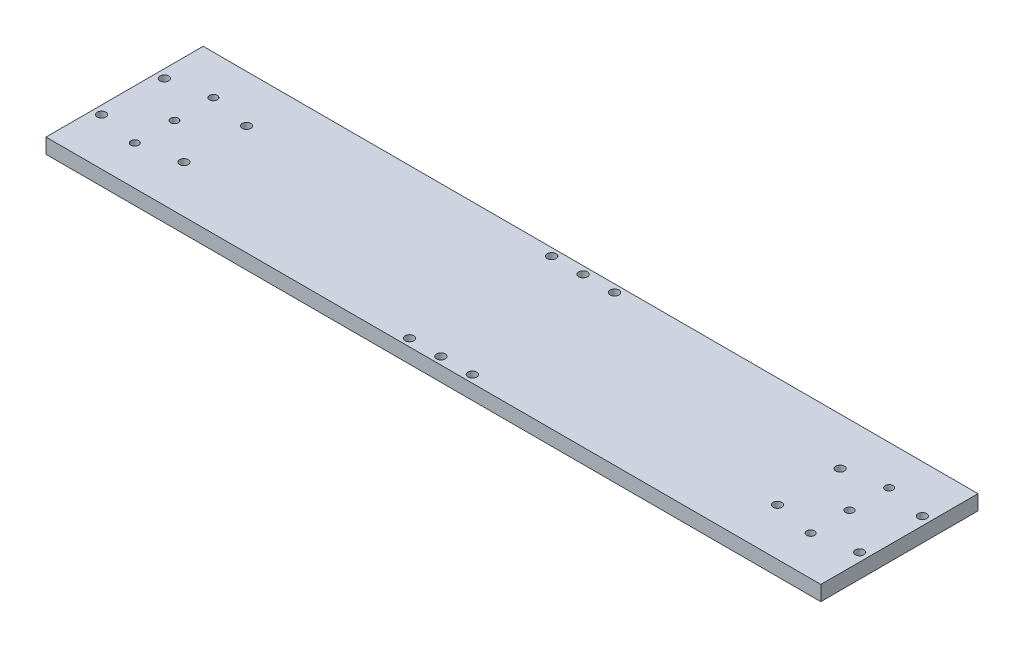
from build123d import *

# Parameters (mm, degrees)
RESSALTO_EXTRUS_O1_DEPTH        = 9.525
ESBO_O5_R                       = 2.78
CORTE_EXTRUS_O2_DEPTH           = 10
ESBO_O8_R                       = 2.75
CORTE_EXTRUS_O4_DEPTH           = 10
ESBO_O9_R                       = 5
CORTE_EXTRUS_O5_DEPTH           = 0.7
ESBO_O10_R                      = 5
CORTE_EXTRUS_O6_DEPTH           = 2.5
CORTE_EXTRUS_O6_DRAFT           = -45
CORTE_EXTRUS_O6_PROFILE_2_DEPTH = 2.5
CORTE_EXTRUS_O6_PROFILE_2_DRAFT = -45
CORTE_EXTRUS_O6_PROFILE_3_DEPTH = 2.5
CORTE_EXTRUS_O6_PROFILE_3_DRAFT = -45
CORTE_EXTRUS_O6_PROFILE_4_DEPTH = 2.5
CORTE_EXTRUS_O6_PROFILE_4_DRAFT = -45
CORTE_EXTRUS_O6_PROFILE_5_DEPTH = 2.5
CORTE_EXTRUS_O6_PROFILE_5_DRAFT = -45
CORTE_EXTRUS_O6_PROFILE_6_DEPTH = 2.5
CORTE_EXTRUS_O6_PROFILE_6_DRAFT = -45
ESBO_O11_R                      = 2.5
CORTE_EXTRUS_O7_DEPTH           = 10


with BuildPart() as part:
    # Esboço3 → Ressalto-extrusão1 (new body)
    with BuildSketch(Plane(origin=(0, 0, 0), x_dir=(1, 0, 0), z_dir=(0, 1, 0))):
        Polygon((-183.495, 37.21932618), (-246.505, 50), (-246.505, -50), (-183.495, -50), align=None)
        Polygon((-183.495, 50), (-183.495, 37.21932618), (183.495, -37.21932618), (183.495, 50), align=None)
        Polygon((183.495, -37.21932618), (-183.495, 37.21932618), (-183.495, -50), (183.495, -50), align=None)
        Polygon((246.505, -50), (183.495, -37.21932618), (183.495, -50), align=None)
        Polygon((183.495, 50), (183.495, -37.21932618), (246.505, -50), (246.505, 50), align=None)
        Polygon((-183.495, 50), (-246.505, 50), (-183.495, 37.21932618), align=None)
    extrude(amount=-RESSALTO_EXTRUS_O1_DEPTH)

    # Esboço5 → Corte-extrusão2 (cut)
    with BuildSketch(Plane(origin=(0, 0, 0), x_dir=(1, 0, 0), z_dir=(0, 1, 0))):
        with Locations(Location((0, -45.235, 0), (0, 0, 270))):
            Circle(ESBO_O5_R)
        with Locations(Location((-20, -45.235, 0), (0, 0, 270))):
            Circle(ESBO_O5_R)
        with Locations(Location((20, -45.235, 0), (0, 0, 270))):
            Circle(ESBO_O5_R)
        with Locations(Location((-20, 45.235, 0), (0, 0, 270))):
            Circle(ESBO_O5_R)
        with Locations(Location((20, 45.235, 0), (0, 0, 270))):
            Circle(ESBO_O5_R)
        with Locations(Location((0, 45.235, 0), (0, 0, 270))):
            Circle(ESBO_O5_R)
    extrude(amount=-CORTE_EXTRUS_O2_DEPTH, mode=Mode.SUBTRACT)

    # Esboço8 → Corte-extrusão4 (cut)
    with BuildSketch(Plane.XZ.offset(9.525)):
        with Locations(Location((-188.84, 19.950903247, 0), (0, 0, 270))):
            Circle(ESBO_O8_R)
        with Locations(Location((-188.84, -19.95, 0), (0, 0, 270))):
            Circle(ESBO_O8_R)
        with Locations(Location((-241.16, 19.950903247, 0), (0, 0, 270))):
            Circle(ESBO_O8_R)
        with Locations(Location((-241.16, -19.95, 0), (0, 0, 270))):
            Circle(ESBO_O8_R)
        with Locations(Location((241.16, -19.95, 0), (0, 0, 90))):
            Circle(ESBO_O8_R)
        with Locations(Location((241.16, 19.950903247, 0), (0, 0, 90))):
            Circle(ESBO_O8_R)
        with Locations(Location((188.84, -19.95, 0), (0, 0, 90))):
            Circle(ESBO_O8_R)
        with Locations(Location((188.84, 19.950903247, 0), (0, 0, 90))):
            Circle(ESBO_O8_R)
    extrude(amount=-CORTE_EXTRUS_O4_DEPTH, mode=Mode.SUBTRACT)

    # Esboço9 → Corte-extrusão5 (cut)
    with BuildSketch(Plane.XZ.offset(9.525)):
        with Locations(Location((215, 25, 0), (0, 0, 270))):
            Circle(ESBO_O9_R)
        with Locations(Location((215, 0, 0), (0, 0, 270))):
            Circle(ESBO_O9_R)
        with Locations(Location((215, -25, 0), (0, 0, 270))):
            Circle(ESBO_O9_R)
        with Locations(Location((-215, -25, 0), (0, 0, 90))):
            Circle(ESBO_O9_R)
        with Locations(Location((-215, 0, 0), (0, 0, 90))):
            Circle(ESBO_O9_R)
        with Locations(Location((-215, 25, 0), (0, 0, 90))):
            Circle(ESBO_O9_R)
    extrude(amount=-CORTE_EXTRUS_O5_DEPTH, mode=Mode.SUBTRACT)


with BuildPart() as corte_extrus_o6_tool:
    # Esboço10 → Corte-extrusão6 (with draft: the straight prism first)
    with BuildSketch(Plane.XZ.offset(8.825)):
        with Locations(Location((215, 25, 0), (0, 0, 270))):
            Circle(ESBO_O10_R)
    extrude(amount=-CORTE_EXTRUS_O6_DEPTH)
    # Corte-extrusão6: the draft: its side faces are tilted about the plane it starts from
    corte_extrus_o6_sides = [corte_extrus_o6_tool.faces().sort_by_distance(p)[0] for p in [
        (215, -7.575, 30),
    ]]
    draft(corte_extrus_o6_sides, Plane.XZ.offset(8.825), CORTE_EXTRUS_O6_DRAFT)


with BuildPart() as part_1:
    add(part.part)

    # Corte-extrusão6: cut by corte_extrus_o6_tool
    add(corte_extrus_o6_tool.part, mode=Mode.SUBTRACT)


with BuildPart() as corte_extrus_o6_profile_2_tool:
    # Esboço10 → Corte-extrusão6 profile 2 (with draft: the straight prism first)
    with BuildSketch(Plane.XZ.offset(8.825)):
        with Locations((214.7625, 0)):
            Circle(ESBO_O10_R)
    extrude(amount=-CORTE_EXTRUS_O6_PROFILE_2_DEPTH)
    # Corte-extrusão6 profile 2: the draft: its side faces are tilted about the plane it starts from
    corte_extrus_o6_profile_2_sides = [corte_extrus_o6_profile_2_tool.faces().sort_by_distance(p)[0] for p in [
        (209.7625, -7.575, 0),
    ]]
    draft(corte_extrus_o6_profile_2_sides, Plane.XZ.offset(8.825), CORTE_EXTRUS_O6_PROFILE_2_DRAFT)


with BuildPart() as part_2:
    add(part_1.part)

    # Corte-extrusão6 profile 2: cut by corte_extrus_o6_profile_2_tool
    add(corte_extrus_o6_profile_2_tool.part, mode=Mode.SUBTRACT)


with BuildPart() as corte_extrus_o6_profile_3_tool:
    # Esboço10 → Corte-extrusão6 profile 3 (with draft: the straight prism first)
    with BuildSketch(Plane.XZ.offset(8.825)):
        with Locations(Location((215, -25, 0), (0, 0, 270))):
            Circle(ESBO_O10_R)
    extrude(amount=-CORTE_EXTRUS_O6_PROFILE_3_DEPTH)
    # Corte-extrusão6 profile 3: the draft: its side faces are tilted about the plane it starts from
    corte_extrus_o6_profile_3_sides = [corte_extrus_o6_profile_3_tool.faces().sort_by_distance(p)[0] for p in [
        (215, -7.575, -20),
    ]]
    draft(corte_extrus_o6_profile_3_sides, Plane.XZ.offset(8.825), CORTE_EXTRUS_O6_PROFILE_3_DRAFT)


with BuildPart() as part_3:
    add(part_2.part)

    # Corte-extrusão6 profile 3: cut by corte_extrus_o6_profile_3_tool
    add(corte_extrus_o6_profile_3_tool.part, mode=Mode.SUBTRACT)


with BuildPart() as corte_extrus_o6_profile_4_tool:
    # Esboço10 → Corte-extrusão6 profile 4 (with draft: the straight prism first)
    with BuildSketch(Plane.XZ.offset(8.825)):
        with Locations(Location((-215, -25, 0), (0, 0, 90))):
            Circle(ESBO_O10_R)
    extrude(amount=-CORTE_EXTRUS_O6_PROFILE_4_DEPTH)
    # Corte-extrusão6 profile 4: the draft: its side faces are tilted about the plane it starts from
    corte_extrus_o6_profile_4_sides = [corte_extrus_o6_profile_4_tool.faces().sort_by_distance(p)[0] for p in [
        (-215, -7.575, -30),
    ]]
    draft(corte_extrus_o6_profile_4_sides, Plane.XZ.offset(8.825), CORTE_EXTRUS_O6_PROFILE_4_DRAFT)


with BuildPart() as part_4:
    add(part_3.part)

    # Corte-extrusão6 profile 4: cut by corte_extrus_o6_profile_4_tool
    add(corte_extrus_o6_profile_4_tool.part, mode=Mode.SUBTRACT)


with BuildPart() as corte_extrus_o6_profile_5_tool:
    # Esboço10 → Corte-extrusão6 profile 5 (with draft: the straight prism first)
    with BuildSketch(Plane.XZ.offset(8.825)):
        with Locations((-214.7625, 0)):
            Circle(ESBO_O10_R)
    extrude(amount=-CORTE_EXTRUS_O6_PROFILE_5_DEPTH)
    # Corte-extrusão6 profile 5: the draft: its side faces are tilted about the plane it starts from
    corte_extrus_o6_profile_5_sides = [corte_extrus_o6_profile_5_tool.faces().sort_by_distance(p)[0] for p in [
        (-219.7625, -7.575, 0),
    ]]
    draft(corte_extrus_o6_profile_5_sides, Plane.XZ.offset(8.825), CORTE_EXTRUS_O6_PROFILE_5_DRAFT)


with BuildPart() as part_5:
    add(part_4.part)

    # Corte-extrusão6 profile 5: cut by corte_extrus_o6_profile_5_tool
    add(corte_extrus_o6_profile_5_tool.part, mode=Mode.SUBTRACT)


with BuildPart() as corte_extrus_o6_profile_6_tool:
    # Esboço10 → Corte-extrusão6 profile 6 (with draft: the straight prism first)
    with BuildSketch(Plane.XZ.offset(8.825)):
        with Locations(Location((-215, 25, 0), (0, 0, 90))):
            Circle(ESBO_O10_R)
    extrude(amount=-CORTE_EXTRUS_O6_PROFILE_6_DEPTH)
    # Corte-extrusão6 profile 6: the draft: its side faces are tilted about the plane it starts from
    corte_extrus_o6_profile_6_sides = [corte_extrus_o6_profile_6_tool.faces().sort_by_distance(p)[0] for p in [
        (-215, -7.575, 20),
    ]]
    draft(corte_extrus_o6_profile_6_sides, Plane.XZ.offset(8.825), CORTE_EXTRUS_O6_PROFILE_6_DRAFT)


with BuildPart() as part_6:
    add(part_5.part)

    # Corte-extrusão6 profile 6: cut by corte_extrus_o6_profile_6_tool
    add(corte_extrus_o6_profile_6_tool.part, mode=Mode.SUBTRACT)

    # Esboço11 → Corte-extrusão7 (cut)
    with BuildSketch(Plane.XZ.offset(9.525)):
        with Locations(Location((215, 25, 0), (0, 0, 270))):
            Circle(ESBO_O11_R)
        with Locations(Location((214.7625, 0, 0), (0, 0, 270))):
            Circle(ESBO_O11_R)
        with Locations(Location((215, -25, 0), (0, 0, 270))):
            Circle(ESBO_O11_R)
        with Locations(Location((-215, -25, 0), (0, 0, 90))):
            Circle(ESBO_O11_R)
        with Locations(Location((-214.7625, 0, 0), (0, 0, 90))):
            Circle(ESBO_O11_R)
        with Locations(Location((-215, 25, 0), (0, 0, 90))):
            Circle(ESBO_O11_R)
    extrude(amount=-CORTE_EXTRUS_O7_DEPTH, mode=Mode.SUBTRACT)


solid = part_6.part
